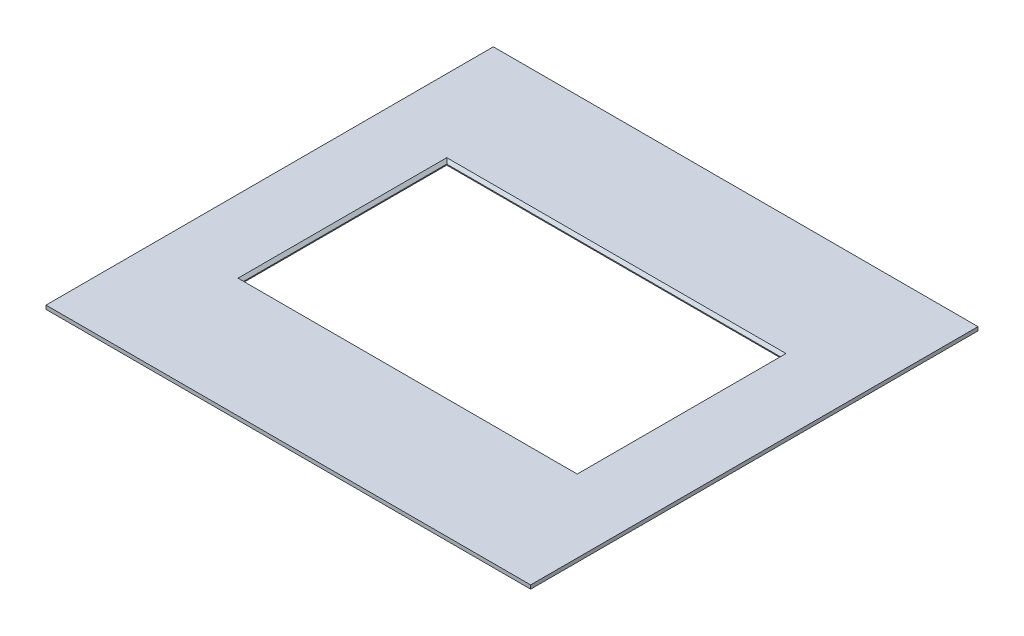
from build123d import *

# Parameters (mm, degrees)
SKETCH1_W           = 130
SKETCH1_H           = 120
SKETCH1_W_2         = 89.5
SKETCH1_H_2         = 54.5
BOSS_EXTRUDE1_DEPTH = 1
CHAMFER1_SIZE       = 0.75


with BuildPart() as part:
    # Sketch1 → Boss-Extrude1 (new body)
    with BuildSketch(Plane(origin=(0, 0, 0), x_dir=(1, 0, 0), z_dir=(0, 1, 0))):
        Rectangle(SKETCH1_W, SKETCH1_H)
        Rectangle(SKETCH1_W_2, SKETCH1_H_2, mode=Mode.SUBTRACT)
    extrude(amount=BOSS_EXTRUDE1_DEPTH)

    # Chamfer1
    chamfer1_edges = [part.edges().sort_by_distance(p)[0] for p in [
        (44.75, 1, 0),
        (0, 1, -27.25),
        (-44.75, 1, 0),
        (0, 1, 27.25),
    ]]
    chamfer(chamfer1_edges, length=CHAMFER1_SIZE)


solid = part.part
